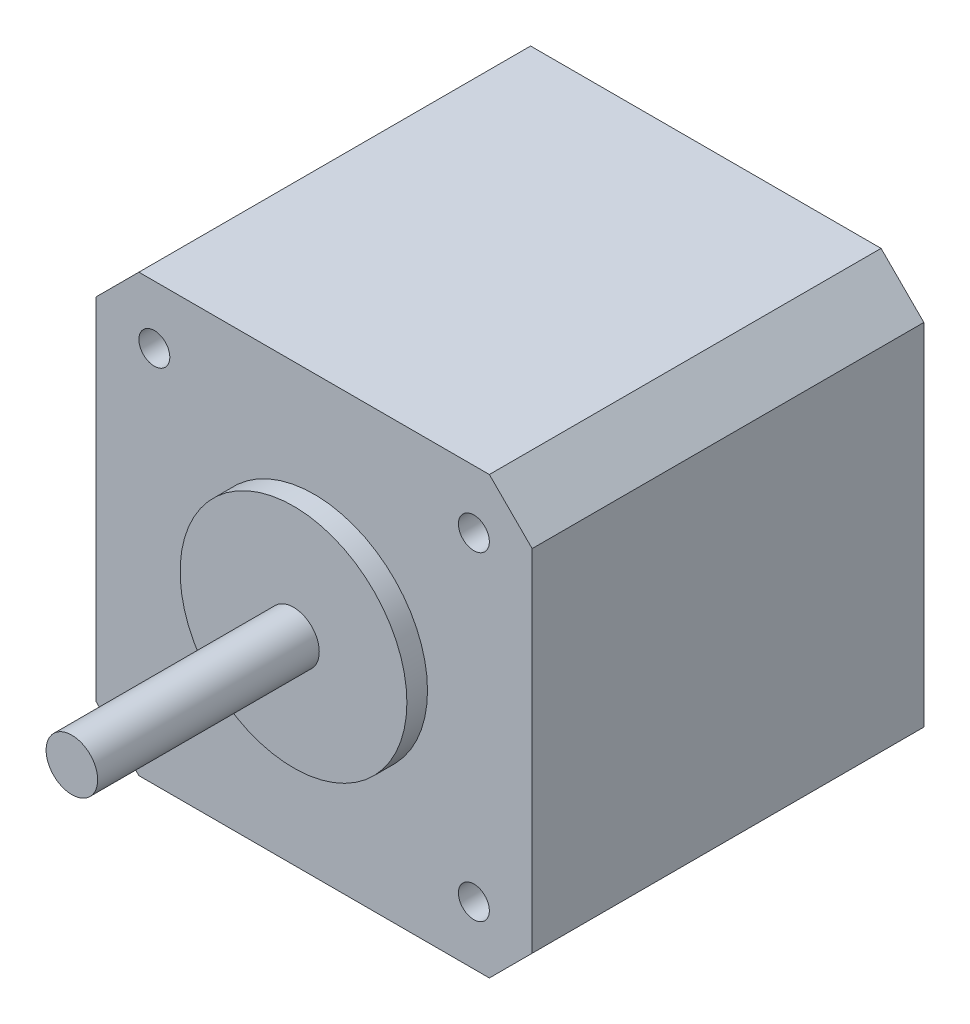
from build123d import *

# Parameters (mm, degrees)
EXTRUDE_1_DEPTH     = 38
SKETCH_2_R          = 11
EXTRUDE_2_DEPTH     = 2
SKETCH_3_R          = 2.5
EXTRUDE_3_DEPTH     = 21.5
CUT_EXTRUDE_1_REACH = 80.461
SKETCH_4_R          = 1.5


with BuildPart() as part:
    # 草图1 → 凸台-拉伸1 (new body)
    with BuildSketch(Plane.XY):
        Polygon((-39.221447105, 9.245047294), (-35.071447105, 13.395047294), (-1.071447105, 13.395047294), (3.078552895, 9.245047294), (3.078552895, -24.754952706), (-1.071447105, -28.904952706), (-35.071447105, -28.904952706), (-39.221447105, -24.754952706), align=None)
    extrude(amount=EXTRUDE_1_DEPTH)

    # 草图2 → 凸台-拉伸2 (add)
    with BuildSketch(Plane.XY.offset(38)):
        with Locations((-18.071447105, -7.754952706)):
            Circle(SKETCH_2_R)
    extrude(amount=EXTRUDE_2_DEPTH)

    # 草图3 → 凸台-拉伸3 (add)
    with BuildSketch(Plane.XY.offset(40)):
        with Locations((-18.071447105, -7.754952706)):
            Circle(SKETCH_3_R)
    extrude(amount=EXTRUDE_3_DEPTH)

    # 草图4 → 切除-拉伸1 (cut, up to next)
    with BuildSketch(Plane(origin=(0, 0, 0), x_dir=(-1, 0, 0), z_dir=(0, 0, -1)), mode=Mode.PRIVATE) as cut_extrude_1_sk1:
        with Locations((2.571447105, 7.745047294)):
            Circle(SKETCH_4_R)
    cut_extrude_1_tool1 = extrude(cut_extrude_1_sk1.sketch, amount=-CUT_EXTRUDE_1_REACH, mode=Mode.PRIVATE) & part.part
    # 草图4 → 切除-拉伸1 (cut, up to next)
    with BuildSketch(Plane(origin=(0, 0, 0), x_dir=(-1, 0, 0), z_dir=(0, 0, -1)), mode=Mode.PRIVATE) as cut_extrude_1_sk2:
        with Locations((2.571447105, -23.254952706)):
            Circle(SKETCH_4_R)
    cut_extrude_1_tool2 = extrude(cut_extrude_1_sk2.sketch, amount=-CUT_EXTRUDE_1_REACH, mode=Mode.PRIVATE) & part.part
    # 草图4 → 切除-拉伸1 (cut, up to next)
    with BuildSketch(Plane(origin=(0, 0, 0), x_dir=(-1, 0, 0), z_dir=(0, 0, -1)), mode=Mode.PRIVATE) as cut_extrude_1_sk3:
        with Locations((33.571447105, -23.254952706)):
            Circle(SKETCH_4_R)
    cut_extrude_1_tool3 = extrude(cut_extrude_1_sk3.sketch, amount=-CUT_EXTRUDE_1_REACH, mode=Mode.PRIVATE) & part.part
    # 草图4 → 切除-拉伸1 (cut, up to next)
    with BuildSketch(Plane(origin=(0, 0, 0), x_dir=(-1, 0, 0), z_dir=(0, 0, -1)), mode=Mode.PRIVATE) as cut_extrude_1_sk4:
        with Locations((33.571447105, 7.745047294)):
            Circle(SKETCH_4_R)
    cut_extrude_1_tool4 = extrude(cut_extrude_1_sk4.sketch, amount=-CUT_EXTRUDE_1_REACH, mode=Mode.PRIVATE) & part.part
    add(cut_extrude_1_tool1.solids().sort_by_distance((-2.571447, 7.745047, 0))[0], mode=Mode.SUBTRACT)
    add(cut_extrude_1_tool2.solids().sort_by_distance((-2.571447, -23.254953, 0))[0], mode=Mode.SUBTRACT)
    add(cut_extrude_1_tool3.solids().sort_by_distance((-33.571447, -23.254953, 0))[0], mode=Mode.SUBTRACT)
    add(cut_extrude_1_tool4.solids().sort_by_distance((-33.571447, 7.745047, 0))[0], mode=Mode.SUBTRACT)


solid = part.part
